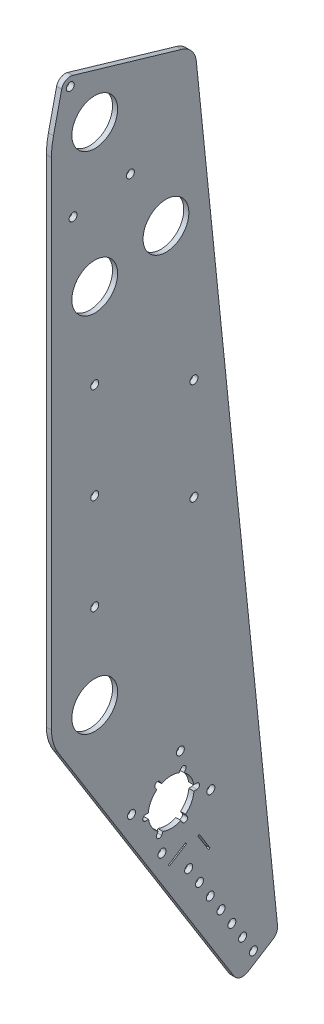
from build123d import *

# Parameters (mm, degrees)
SKETCH1_R           = 2.499995
SKETCH1_R_2         = 2.5
SKETCH1_R_3         = 14.2875
BOSS_EXTRUDE1_DEPTH = 3.175


with BuildPart() as part:
    # Sketch1 → Boss-Extrude1 (new body)
    with BuildSketch(Plane(origin=(1.5875, 0, 0), x_dir=(0, 0, -1), z_dir=(1, 0, 0))):
        with BuildLine():
            Line((54.345399121, 12.19455323), (-13.718855966, 32.143669532))
            ThreePointArc((-13.718855966, 32.143669532), (-18.053428342, 31.606906651), (-20.630025283, 28.080182921))
            Line((-20.630025283, 28.080182921), (-25.733530559, 5.5386286))
            ThreePointArc((-25.733530559, 5.5386286), (-26.673034326, -0.035153342), (-26.9875, -5.678806752))
            Line((-26.9875, -5.678806752), (-26.9875, -314.995580316))
            ThreePointArc((-26.9875, -314.995580316), (-25.942050019, -322.434343457), (-22.886697995, -329.29677646))
            Line((-22.886697995, -329.29677646), (86.89264859, -504.980455375))
            ThreePointArc((86.89264859, -504.980455375), (90.849314805, -507.802717959), (95.642741328, -507.000573458))
            Line((95.642741328, -507.000573458), (111.133848853, -497.320655139))
            ThreePointArc((111.133848853, -497.320655139), (113.473140107, -494.725479093), (114.085519672, -491.285680619))
            Line((114.085519672, -491.285680619), (63.406704813, 1.306972618))
            ThreePointArc((63.406704813, 1.306972618), (60.534946173, 8.131395413), (54.345399121, 12.19455323))
        make_face()
        with Locations(Location((0, -261.947790158, 0), (0, 0, 180))):
            Circle(SKETCH1_R, mode=Mode.SUBTRACT)
        with Locations(Location((0, -141.947790158, 0), (0, 0, 180))):
            Circle(SKETCH1_R, mode=Mode.SUBTRACT)
        with Locations(Location((22.230640813, -39.122879855, 0), (0, 0, 180))):
            Circle(SKETCH1_R, mode=Mode.SUBTRACT)
        with Locations(Location((-13.49375, -44.45, 0), (0, 0, 180))):
            Circle(SKETCH1_R, mode=Mode.SUBTRACT)
        with Locations(Location((41.976634925, -416.065160512, 0), (0, 0, 180))):
            Circle(SKETCH1_R_2, mode=Mode.SUBTRACT)
        with Locations(Location((72.439391351, -397.029917647, 0), (0, 0, 180))):
            Circle(SKETCH1_R_2, mode=Mode.SUBTRACT)
        with Locations(Location((53.404148486, -366.567161221, 0), (0, 0, 180))):
            Circle(SKETCH1_R_2, mode=Mode.SUBTRACT)
        with Locations(Location((22.94139206, -385.602404086, 0), (0, 0, 180))):
            Circle(SKETCH1_R_2, mode=Mode.SUBTRACT)
        with Locations(Location((0, -201.947790158, 0), (0, 0, 180))):
            Circle(SKETCH1_R_2, mode=Mode.SUBTRACT)
        with Locations(Location((61.9125, -233.697790158, 0), (0, 0, 180))):
            Circle(SKETCH1_R_2, mode=Mode.SUBTRACT)
        with Locations(Location((61.9125, -170.197790158, 0), (0, 0, 180))):
            Circle(SKETCH1_R_2, mode=Mode.SUBTRACT)
        with Locations(Location((0, 0, 0), (0, 0, 180))):
            Circle(SKETCH1_R_3, mode=Mode.SUBTRACT)
        with Locations(Location((0, -88.9, 0), (0, 0, 180))):
            Circle(SKETCH1_R_3, mode=Mode.SUBTRACT)
        with Locations(Location((0, -314.995580316, 0), (0, 0, 180))):
            Circle(SKETCH1_R_3, mode=Mode.SUBTRACT)
        with Locations(Location((44.461281626, -78.24575971, 0), (0, 0, 180))):
            Circle(SKETCH1_R_3, mode=Mode.SUBTRACT)
        with Locations(Location((58.629287829, -432.78796896, 0), (0, 0, 180))):
            Circle(SKETCH1_R_2, mode=Mode.SUBTRACT)
        with Locations(Location((65.359262485, -443.558179782, 0), (0, 0, 180))):
            Circle(SKETCH1_R_2, mode=Mode.SUBTRACT)
        with Locations(Location((72.089237141, -454.328390603, 0), (0, 0, 180))):
            Circle(SKETCH1_R_2, mode=Mode.SUBTRACT)
        with Locations(Location((78.819211796, -465.098601424, 0), (0, 0, 180))):
            Circle(SKETCH1_R_2, mode=Mode.SUBTRACT)
        with Locations(Location((85.549186452, -475.868812245, 0), (0, 0, 180))):
            Circle(SKETCH1_R_2, mode=Mode.SUBTRACT)
        with Locations(Location((92.279161108, -486.639023066, 0), (0, 0, 180))):
            Circle(SKETCH1_R_2, mode=Mode.SUBTRACT)
        with Locations(Location((99.009135764, -497.409233887, 0), (0, 0, 180))):
            Circle(SKETCH1_R_2, mode=Mode.SUBTRACT)
        with Locations(Location((-15.265789691, 26.86569681, 0), (0, 0, 180))):
            Circle(SKETCH1_R_2, mode=Mode.SUBTRACT)
        with BuildLine():
            Line((40.695767644, -376.820032614), (41.660262631, -378.363547244))
            ThreePointArc((41.660262631, -378.363547244), (47.191765144, -377.037364423), (52.802303033, -377.974458618))
            Line((52.802303033, -377.974458618), (53.656778421, -376.367424143))
            ThreePointArc((53.656778421, -376.367424143), (56.023511943, -375.64384109), (56.747094996, -378.010574612))
            Line((56.747094996, -378.010574612), (55.892619609, -379.617609087))
            ThreePointArc((55.892619609, -379.617609087), (59.806878879, -383.744939376), (61.800600445, -389.072354815))
            Line((61.800600445, -389.072354815), (63.619570819, -389.008834969))
            ThreePointArc((63.619570819, -389.008834969), (65.429578885, -390.696694798), (63.741719057, -392.506702864))
            Line((63.741719057, -392.506702864), (61.922748683, -392.570222709))
            ThreePointArc((61.922748683, -392.570222709), (60.305505438, -398.023735817), (56.688689115, -402.41405706))
            Line((56.688689115, -402.41405706), (57.653184101, -403.95757169))
            ThreePointArc((57.653184101, -403.95757169), (57.096458646, -406.369014571), (54.685015765, -405.812289115))
            Line((54.685015765, -405.812289115), (53.720520779, -404.268774485))
            ThreePointArc((53.720520779, -404.268774485), (48.189018265, -405.594957305), (42.578480376, -404.65786311))
            Line((42.578480376, -404.65786311), (41.724004989, -406.264897585))
            ThreePointArc((41.724004989, -406.264897585), (39.357271466, -406.988480637), (38.633688414, -404.621747115))
            Line((38.633688414, -404.621747115), (39.488163801, -403.01471264))
            ThreePointArc((39.488163801, -403.01471264), (35.573904532, -398.887382352), (33.580182967, -393.559966914))
            Line((33.580182967, -393.559966914), (31.761212592, -393.623486759))
            ThreePointArc((31.761212592, -393.623486759), (29.951204527, -391.935626932), (31.639064354, -390.125618866))
            Line((31.639064354, -390.125618866), (33.458034728, -390.062099021))
            ThreePointArc((33.458034728, -390.062099021), (35.075277972, -384.608585913), (38.692094295, -380.218264669))
            Line((38.692094295, -380.218264669), (37.727599308, -378.674750039))
            ThreePointArc((37.727599308, -378.674750039), (38.284324764, -376.263307159), (40.695767644, -376.820032614))
        make_face(mode=Mode.SUBTRACT)
        Polygon((45.984288499, -424.534697371), (56.75449932, -417.804722715), (57.284418584, -418.652770811), (46.514207763, -425.382745467), align=None, mode=Mode.SUBTRACT)
        Polygon((65.200065755, -417.450416925), (71.930040411, -428.220627746), (71.081992315, -428.75054701), (64.352017658, -417.980336189), align=None, mode=Mode.SUBTRACT)
    extrude(amount=-BOSS_EXTRUDE1_DEPTH)


solid = part.part
